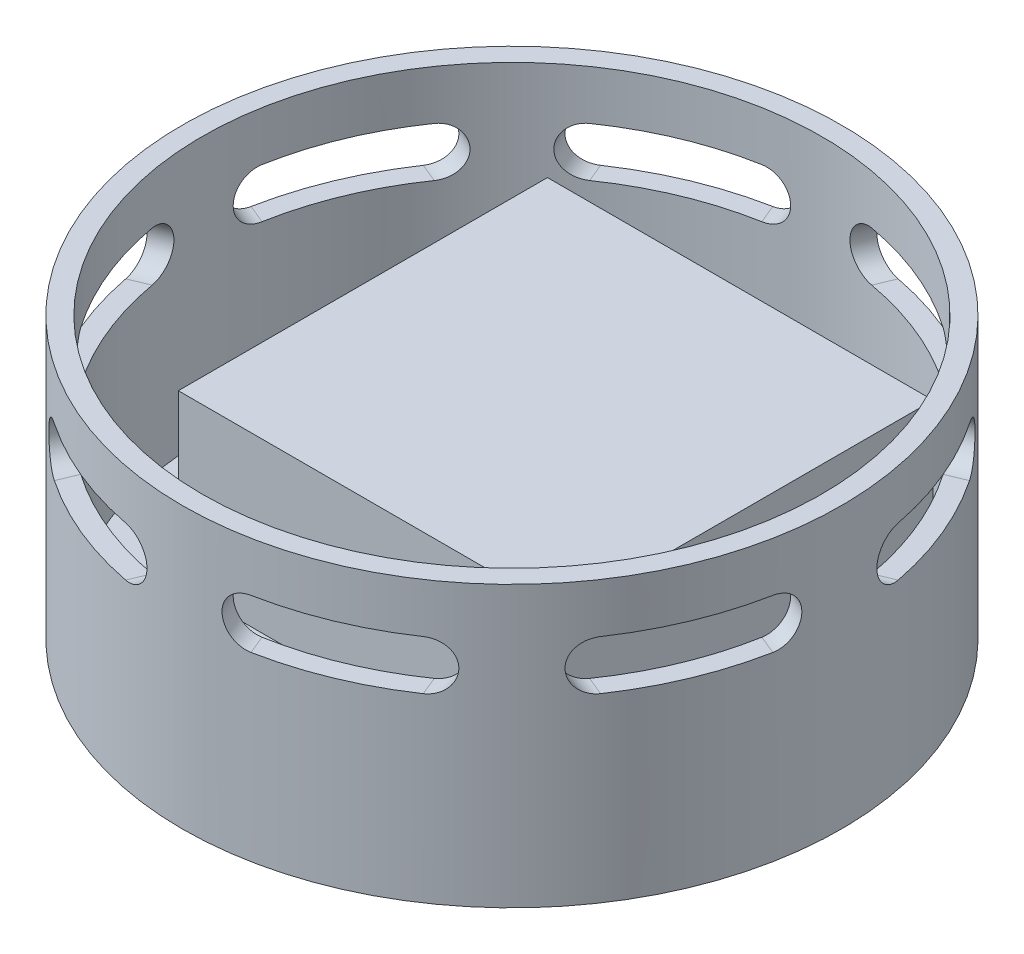
from build123d import *

# Parameters (mm, degrees)
SKETCH1_R               = 94
BOSS_EXTRUDE1_DEPTH     = 5
SKETCH1_3_R             = 100
SKETCH1_3_R_2           = 94
BOSS_EXTRUDE2_DEPTH     = 85
CUT_EXTRUDE1_REACH      = 167
CUT_EXTRUDE1_END_RADIUS = 100
CIRPATTERN1_COUNT       = 8
SKETCH2_W               = 117
SKETCH2_H               = 112
BOSS_EXTRUDE6_DEPTH     = 51


with BuildPart() as part:
    # Sketch1 → Boss-Extrude1 (new body)
    with BuildSketch(Plane(origin=(0, 0, 0), x_dir=(1, 0, 0), z_dir=(0, 1, 0))):
        Circle(SKETCH1_R)
    extrude(amount=BOSS_EXTRUDE1_DEPTH)

    # Sketch1<3> → Boss-Extrude2 (add)
    with BuildSketch(Plane(origin=(0, 0, 0), x_dir=(1, 0, 0), z_dir=(0, 1, 0))):
        Circle(SKETCH1_3_R)
        Circle(SKETCH1_3_R_2, mode=Mode.SUBTRACT)
    extrude(amount=BOSS_EXTRUDE2_DEPTH)

    # Cut-Extrude1: up to this cylinder (the profile starts inside it)
    cut_extrude1_end = Plane(origin=(0, 62.5, 0), z_dir=(0, -1, 0)) * Cylinder(CUT_EXTRUDE1_END_RADIUS, 535, mode=Mode.PRIVATE)
    # Sketch4 → Cut-Extrude1 (cut, up to the surface)
    with BuildSketch(Plane(origin=(0, 0, 0), x_dir=(0.9238795325112865, 0, 0.3826834323650906), z_dir=(-0.3826834323650906, 0, 0.9238795325112865)), mode=Mode.PRIVATE) as cut_extrude1_sk1:
        with BuildLine():
            Line((20, 70), (-20, 70))
            ThreePointArc((-20, 70), (-27.5, 62.5), (-20, 55))
            Line((-20, 55), (0, 55))
            Line((0, 55), (20, 55))
            ThreePointArc((20, 55), (27.5, 62.5), (20, 70))
        make_face()
    cut_extrude1_tool1 = extrude(cut_extrude1_sk1.sketch, amount=CUT_EXTRUDE1_REACH, mode=Mode.PRIVATE) & cut_extrude1_end
    cut_extrude1 = cut_extrude1_tool1.solids().sort_by_distance((0, 62.5, 0))[0]
    add(cut_extrude1, mode=Mode.SUBTRACT)

    # CirPattern1: Cut-Extrude1 ×8 about axis
    cirpattern1_axis = Axis((0, 85, 0), (0, -1, 0))
    for i in range(1, CIRPATTERN1_COUNT):
        add(cut_extrude1.rotate(cirpattern1_axis, i * 360 / CIRPATTERN1_COUNT), mode=Mode.SUBTRACT)

    # Sketch2 → Boss-Extrude6 (add)
    with BuildSketch(Plane(origin=(0, 5, 0), x_dir=(1, 0, 0), z_dir=(0, 1, 0))):
        with Locations((-1.299086632, 14.578189703)):
            Rectangle(SKETCH2_W, SKETCH2_H)
    extrude(amount=BOSS_EXTRUDE6_DEPTH)


solid = part.part
